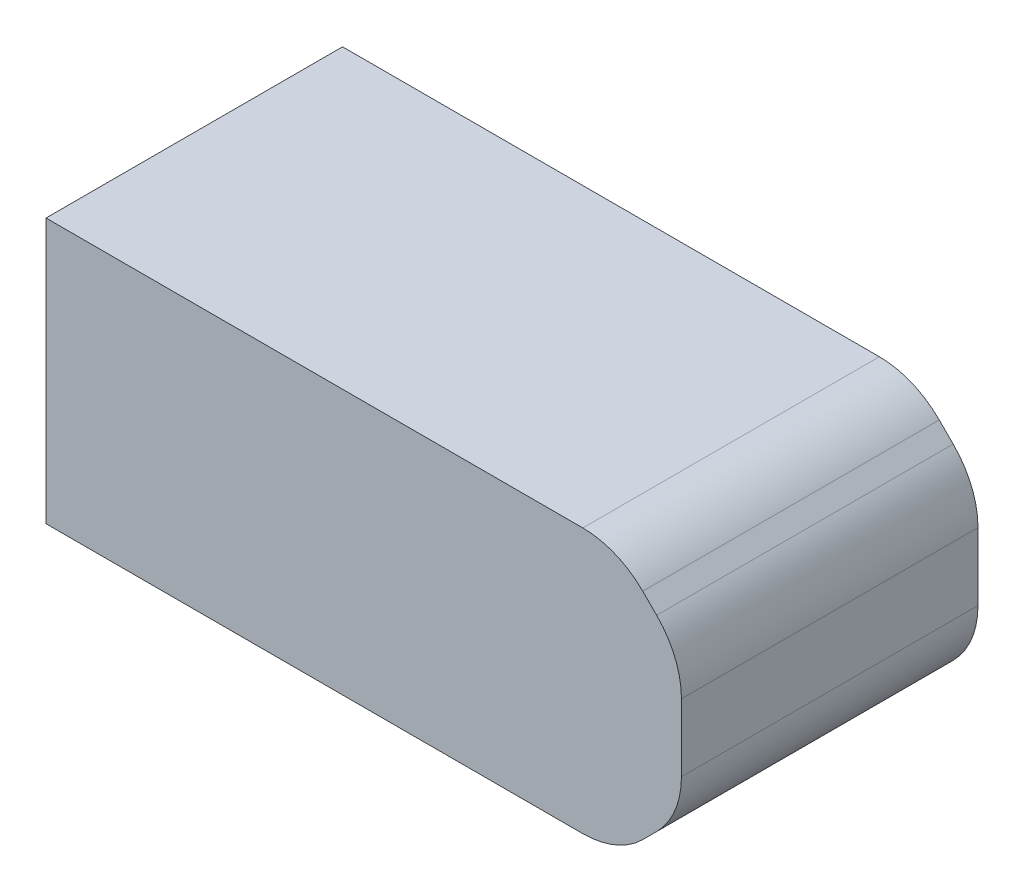
from build123d import *

# Parameters (mm, degrees)
SKETCH2_W           = 60
SKETCH2_H           = 28
BOSS_EXTRUDE1_DEPTH = 25
CHAMFER1_SIZE       = 6
FILLET1_R           = 8
FILLET2_R           = 8


with BuildPart() as part:
    # Sketch2 → Boss-Extrude1 (new body)
    with BuildSketch(Plane(origin=(0, 0, 0), x_dir=(1, 0, 0), z_dir=(0, 1, 0))):
        Rectangle(SKETCH2_W, SKETCH2_H)
    extrude(amount=BOSS_EXTRUDE1_DEPTH)

    # Chamfer1
    chamfer1_edges = [part.edges().sort_by_distance(p)[0] for p in [
        (30, 25, 0),
        (30, 0, 0),
    ]]
    chamfer(chamfer1_edges, length=CHAMFER1_SIZE)

    # Fillet1
    fillet1_edges = [part.edges().sort_by_distance(p)[0] for p in [
        (30, 19, 0),
        (30, 6, 0),
    ]]
    fillet(fillet1_edges, radius=FILLET1_R)

    # Fillet2
    fillet2_edges = [part.edges().sort_by_distance(p)[0] for p in [
        (24, 0, 0),
        (24, 25, 0),
    ]]
    fillet(fillet2_edges, radius=FILLET2_R)


solid = part.part
